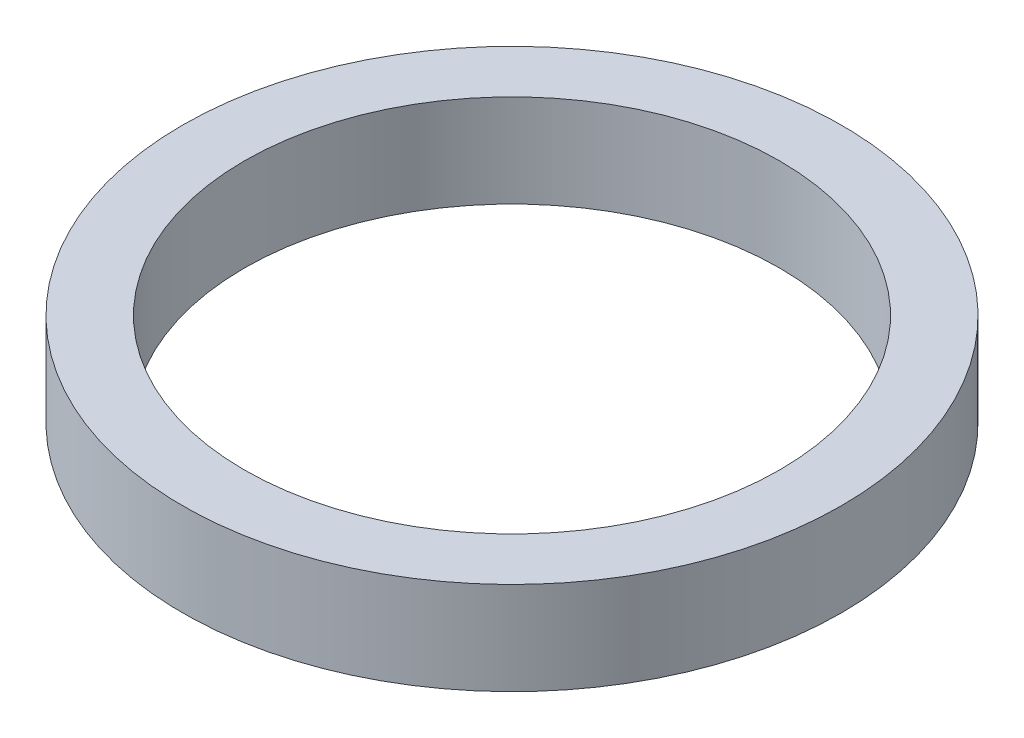
from build123d import *

# Parameters (mm, degrees)
SZKIC1_W = 20
SZKIC1_H = 30


with BuildPart() as part:
    # Szkic1 → Obrót1 (revolve)
    with BuildSketch(Plane.XY):
        with Locations((-96.5, 15)):
            Rectangle(SZKIC1_W, SZKIC1_H)
    revolve(axis=Axis((0, 10, 0), (0, -1, 0)))


solid = part.part
